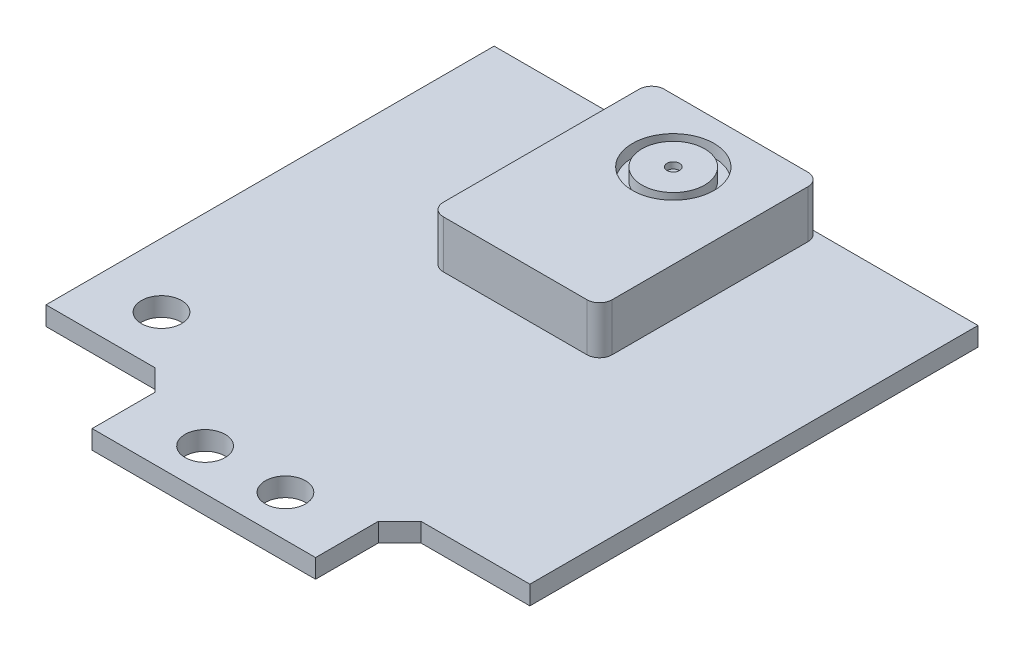
from build123d import *

# Parameters (mm, degrees)
SKETCH_1_R          = 1.6
EXTRUDE_1_DEPTH     = 1.5
EXTRUDE_START       = 1.5
EXTRUDE_2_DEPTH     = 3.8
CUT_EXTRUDE_START   = 5.3
SKETCH_1_4_R        = 3.25
SKETCH_1_4_R_2      = 2.5
CUT_EXTRUDE_1_DEPTH = 1
SKETCH_2_R          = 0.5
CUT_EXTRUDE_2_DEPTH = 0.5


with BuildPart() as part:
    # Эскиз1 → Бобышка-Вытянуть1 (new body)
    with BuildSketch(Plane(origin=(0, 0, 0), x_dir=(1, 0, 0), z_dir=(0, 1, 0))):
        Polygon((-19.275, 17.85), (19.275, 17.85), (19.275, -17.85), (10.6, -17.85), (8.9, -19.55), (8.9, -24.55), (-8.9, -24.55), (-8.9, -19.55), (-10.6, -17.85), (-19.275, -17.85), align=None)
        with Locations(Location((-14.175, -13.75, 0), (0, 0, 270))):
            Circle(SKETCH_1_R, mode=Mode.SUBTRACT)
        with Locations(Location((-3.2, -21.25, 0), (0, 0, 270))):
            Circle(SKETCH_1_R, mode=Mode.SUBTRACT)
        with Locations(Location((3.2, -21.25, 0), (0, 0, 270))):
            Circle(SKETCH_1_R, mode=Mode.SUBTRACT)
    extrude(amount=EXTRUDE_1_DEPTH)


with BuildPart() as body_2:
    # Эскиз1<3> → Бобышка-Вытянуть2 (new body)
    with BuildSketch(Plane(origin=(0, 0, 0), x_dir=(1, 0, 0), z_dir=(0, 1, 0)).offset(EXTRUDE_START)):
        with BuildLine():
            Line((5.725, 0.25), (-5.725, 0.25))
            ThreePointArc((-5.725, 0.25), (-6.432106781, 0.542893219), (-6.725, 1.25))
            Line((-6.725, 1.25), (-6.725, 16.85))
            ThreePointArc((-6.725, 16.85), (-6.432106781, 17.557106781), (-5.725, 17.85))
            Line((-5.725, 17.85), (5.725, 17.85))
            ThreePointArc((5.725, 17.85), (6.432106781, 17.557106781), (6.725, 16.85))
            Line((6.725, 16.85), (6.725, 1.25))
            ThreePointArc((6.725, 1.25), (6.432106781, 0.542893219), (5.725, 0.25))
        make_face()
    extrude(amount=EXTRUDE_2_DEPTH)

    # Эскиз1<4> → Вырез-Вытянуть1 (cut)
    with BuildSketch(Plane(origin=(0, 0, 0), x_dir=(1, 0, 0), z_dir=(0, 1, 0)).offset(CUT_EXTRUDE_START)):
        with Locations(Location((0, 12.85, 0), (0, 0, 90))):
            Circle(SKETCH_1_4_R)
        with Locations(Location((0, 12.85, 0), (0, 0, 90))):
            Circle(SKETCH_1_4_R_2, mode=Mode.SUBTRACT)
    extrude(amount=-CUT_EXTRUDE_1_DEPTH, mode=Mode.SUBTRACT)

    # Эскиз2 → Вырез-Вытянуть2 (cut)
    with BuildSketch(Plane(origin=(0, 5.3, 0), x_dir=(1, 0, 0), z_dir=(0, 1, 0))):
        with Locations(Location((0, 12.85, 0), (0, 0, 270))):
            Circle(SKETCH_2_R)
    extrude(amount=-CUT_EXTRUDE_2_DEPTH, mode=Mode.SUBTRACT)


solid = Compound([part.part, body_2.part])
